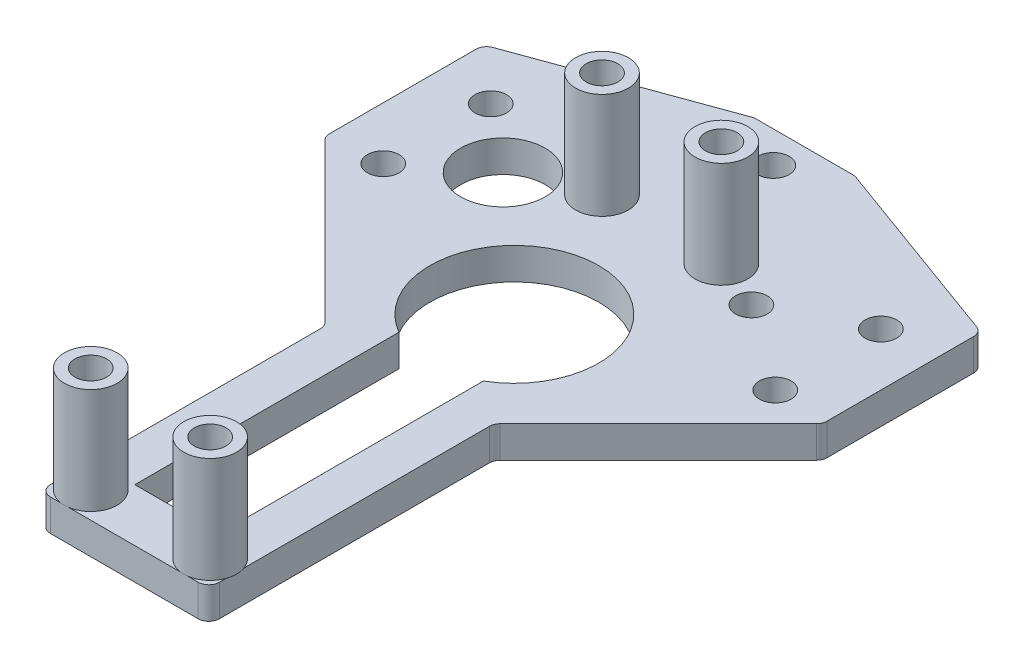
from build123d import *

# Parameters (mm, degrees)
SKETCH2_R           = 1.5
SKETCH2_R_2         = 4
BOSS_EXTRUDE1_DEPTH = 3
FILLET1_R           = 1
SKETCH3_R           = 2.5
SKETCH3_R_2         = 1.5
BOSS_EXTRUDE2_DEPTH = 10


with BuildPart() as part:
    # Sketch2 → Boss-Extrude1 (new body)
    with BuildSketch(Plane(origin=(0, 0, 0), x_dir=(1, 0, 0), z_dir=(0, 1, 0))):
        Polygon((-8.294289656, -10.720618034), (7.705710344, -10.720618034), (7.705710344, 16.279381966), (23.26205953, 31.835731152), (23.26205953, 46.835731152), (4.468207115, 53.676134019), (-5.056786426, 53.676134019), (-23.850638842, 46.835731152), (-23.850638842, 31.835731152), (-8.294289656, 16.279381966), align=None)
        with Locations(Location((-18.673072061, 42.353587832, 0), (0, 0, 270))):
            Circle(SKETCH2_R, mode=Mode.SUBTRACT)
        with Locations(Location((-18.850638842, 32.355164454, 0), (0, 0, 270))):
            Circle(SKETCH2_R, mode=Mode.SUBTRACT)
        with Locations(Location((18.26205953, 42.353587832, 0), (0, 0, 270))):
            Circle(SKETCH2_R, mode=Mode.SUBTRACT)
        with Locations(Location((18.26205953, 32.355164454, 0), (0, 0, 270))):
            Circle(SKETCH2_R, mode=Mode.SUBTRACT)
        with Locations(Location((10.151611088, 38.205004286, 0), (0, 0, 270))):
            Circle(SKETCH2_R, mode=Mode.SUBTRACT)
        with Locations(Location((-0.243415208, 50.676565418, 0), (0, 0, 270))):
            Circle(SKETCH2_R, mode=Mode.SUBTRACT)
        with Locations(Location((-12.470186562, 37.301438638, 0), (0, 0, 270))):
            Circle(SKETCH2_R_2, mode=Mode.SUBTRACT)
        with BuildLine():
            Line((-4.294289656, -5.720618034), (3.705710344, -5.720618034))
            Line((3.705710344, -5.720618034), (3.705710344, 19.279381966))
            ThreePointArc((3.705710344, 19.279381966), (-0.294289656, 34.207585197), (-4.294289656, 19.279381966))
            Line((-4.294289656, 19.279381966), (-4.294289656, -5.720618034))
        make_face(mode=Mode.SUBTRACT)
    extrude(amount=BOSS_EXTRUDE1_DEPTH)

    # Fillet1
    fillet1_edges = [part.edges().sort_by_distance(p)[0] for p in [
        (7.705710344, 1.5, -16.279381966),
        (7.705710344, 1.5, 10.720618034),
        (-8.294289656, 1.5, 10.720618034),
        (-8.294289656, 1.5, -16.279381966),
        (-23.850638842, 1.5, -31.835731152),
        (-23.850638842, 1.5, -46.835731152),
        (-5.056786426, 1.5, -53.676134019),
        (4.468207115, 1.5, -53.676134019),
        (23.26205953, 1.5, -46.835731152),
        (23.26205953, 1.5, -31.835731152),
    ]]
    fillet(fillet1_edges, radius=FILLET1_R)

    # Sketch3 → Boss-Extrude2 (add)
    # profile 1 of 4: a face of its own
    with BuildSketch(Plane(origin=(0, 3, 0), x_dir=(1, 0, 0), z_dir=(0, 1, 0))):
        with Locations(Location((-5.944289656, -8.242414803, 0), (0, 0, 160.051556411))):
            Circle(SKETCH3_R)
        with Locations(Location((-5.944289656, -8.242414803, 0), (0, 0, 270))):
            Circle(SKETCH3_R_2, mode=Mode.SUBTRACT)
    # profile 2 of 4: a face of its own
    with BuildSketch(Plane(origin=(0, 3, 0), x_dir=(1, 0, 0), z_dir=(0, 1, 0))):
        with Locations(Location((5.355710344, -8.242414803, 0), (0, 0, 19.948443589))):
            Circle(SKETCH3_R)
        with Locations(Location((5.355710344, -8.242414803, 0), (0, 0, 270))):
            Circle(SKETCH3_R_2, mode=Mode.SUBTRACT)
    # profile 3 of 4: a face of its own
    with BuildSketch(Plane(origin=(0, 3, 0), x_dir=(1, 0, 0), z_dir=(0, 1, 0))):
        with Locations(Location((-5.944289656, 40.157585197, 0), (0, 0, 270))):
            Circle(SKETCH3_R)
        with Locations(Location((-5.944289656, 40.157585197, 0), (0, 0, 270))):
            Circle(SKETCH3_R_2, mode=Mode.SUBTRACT)
    # profile 4 of 4: a face of its own
    with BuildSketch(Plane(origin=(0, 3, 0), x_dir=(1, 0, 0), z_dir=(0, 1, 0))):
        with Locations(Location((5.355710344, 40.157585197, 0), (0, 0, 270))):
            Circle(SKETCH3_R)
        with Locations(Location((5.355710344, 40.157585197, 0), (0, 0, 270))):
            Circle(SKETCH3_R_2, mode=Mode.SUBTRACT)
    extrude(amount=BOSS_EXTRUDE2_DEPTH)


solid = part.part
